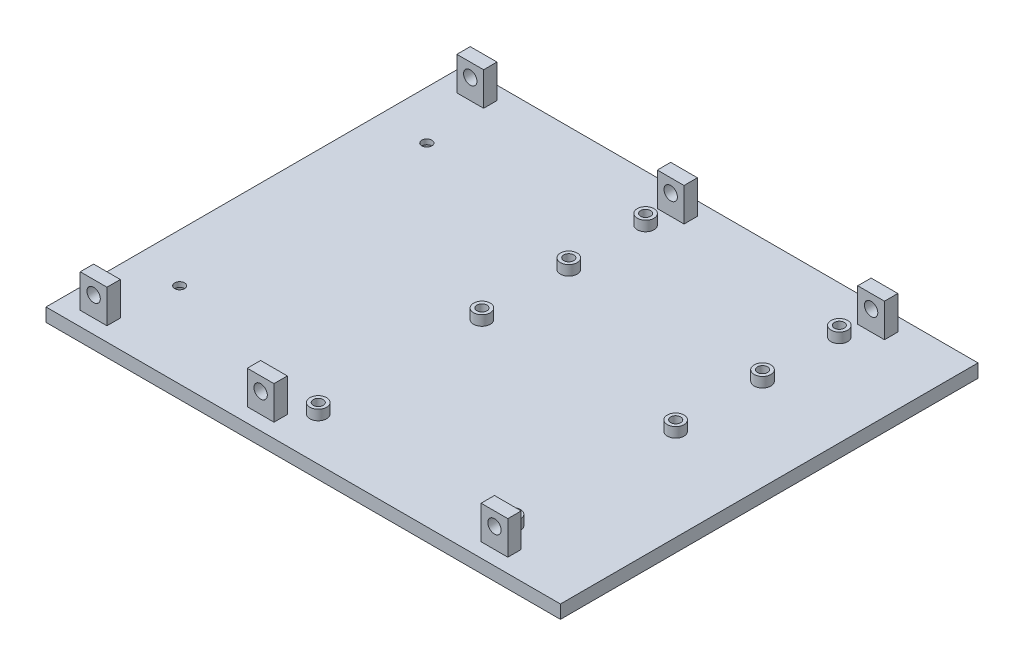
from build123d import *

# Parameters (mm, degrees)
SKETCH1_W                   = 154
SKETCH1_H                   = 125
BOSS_EXTRUDE1_DEPTH         = 4
CUT_EXTRUDE1_REACH          = 101.253
SKETCH3_R                   = 1.5
SKETCH15_R                  = 3
CUT_EXTRUDE7_DEPTH          = 2.5
CUT_EXTRUDE2_REACH          = 101.253
SKETCH4_R                   = 1.5
BOSS_EXTRUDE6_START         = 3
SKETCH17_R                  = 2.5
SKETCH17_R_2                = 1.5
BOSS_EXTRUDE6_DEPTH         = 3
LPATTERN1_COUNT             = 2
LPATTERN1_PITCH             = 58
LPATTERN2_COUNT             = 3
LPATTERN2_PITCH             = 49
LPATTERN2_COPY_1_REACH      = 101.253
LPATTERN2_COPY_1_SKETCH_R   = 1.5
LPATTERN2_COPY_2_REACH      = 101.253
LPATTERN2_COPY_2_SKETCH_R   = 1.5
LPATTERN2_START             = 3
LPATTERN2_COPY_3_SKETCH_R   = 2.5
LPATTERN2_COPY_3_SKETCH_R_2 = 1.5
LPATTERN2_COPY_3_DEPTH      = 3
LPATTERN2_COPY_4_SKETCH_R   = 2.5
LPATTERN2_COPY_4_SKETCH_R_2 = 1.5
LPATTERN2_COPY_4_DEPTH      = 3
LPATTERN3_COUNT             = 2
LPATTERN3_PITCH             = 75
LPATTERN3_COPY_1_REACH      = 101.253
LPATTERN3_COPY_1_SKETCH_R   = 1.5
LPATTERN3_START             = 3
LPATTERN3_COPY_2_SKETCH_R   = 2.5
LPATTERN3_COPY_2_SKETCH_R_2 = 1.5
LPATTERN3_COPY_2_DEPTH      = 3
SKETCH9_W                   = 8
SKETCH9_H                   = 4
BOSS_EXTRUDE4_DEPTH         = 10
CUT_EXTRUDE5_REACH          = 145.894
SKETCH10_R                  = 2
LPATTERN4_COUNT             = 2
LPATTERN4_PITCH             = 50
SKETCH12_W                  = 8
SKETCH12_H                  = 4
BOSS_EXTRUDE5_DEPTH         = 10
CUT_EXTRUDE6_REACH          = 144.588
SKETCH14_R                  = 2
LPATTERN5_COUNT             = 3
LPATTERN5_PITCH             = 60
LPATTERN6_COUNT             = 2
LPATTERN6_PITCH             = 120


with BuildPart() as part:
    # Sketch1 → Boss-Extrude1 (new body)
    with BuildSketch(Plane(origin=(0, 0, 0), x_dir=(1, 0, 0), z_dir=(0, 1, 0))):
        Rectangle(SKETCH1_W, SKETCH1_H)
    extrude(amount=BOSS_EXTRUDE1_DEPTH)

    # Sketch3 → Cut-Extrude1 (cut, up to next)
    with BuildSketch(Plane(origin=(0, 4, 0), x_dir=(1, 0, 0), z_dir=(0, 1, 0)), mode=Mode.PRIVATE) as cut_extrude1_sk1:
        with Locations(Location((-62.5, 37, 0), (0, 0, 270))):
            Circle(SKETCH3_R)
    cut_extrude1_tool1 = extrude(cut_extrude1_sk1.sketch, amount=-CUT_EXTRUDE1_REACH, mode=Mode.PRIVATE) & part.part
    cut_extrude1 = cut_extrude1_tool1.solids().sort_by_distance((-62.5, 4, -37))[0]
    add(cut_extrude1, mode=Mode.SUBTRACT)

    # Sketch15 → Cut-Extrude7 (cut)
    with BuildSketch(Plane.XZ):
        with Locations(Location((-62.5, -37, 0), (0, 0, 270))):
            Circle(SKETCH15_R)
    cut_extrude7 = extrude(amount=-CUT_EXTRUDE7_DEPTH, mode=Mode.SUBTRACT)

    # Mirror1: Cut-Extrude1, Cut-Extrude7 across plane
    add(cut_extrude1.mirror(Plane.XY), mode=Mode.SUBTRACT)
    add(cut_extrude7.mirror(Plane.XY), mode=Mode.SUBTRACT)

    # Sketch4 → Cut-Extrude2 (cut, up to next)
    with BuildSketch(Plane(origin=(0, 4, 0), x_dir=(1, 0, 0), z_dir=(0, 1, 0)), mode=Mode.PRIVATE) as cut_extrude2_sk1:
        with Locations(Location((49.5, -49.5, 0), (0, 0, 270))):
            Circle(SKETCH4_R)
    cut_extrude2_tool1 = extrude(cut_extrude2_sk1.sketch, amount=-CUT_EXTRUDE2_REACH, mode=Mode.PRIVATE) & part.part
    cut_extrude2 = cut_extrude2_tool1.solids().sort_by_distance((49.5, 4, 49.5))[0]
    add(cut_extrude2, mode=Mode.SUBTRACT)

    # Sketch17 → Boss-Extrude6 (add)
    with BuildSketch(Plane(origin=(0, 4, 0), x_dir=(1, 0, 0), z_dir=(0, 1, 0)).offset(BOSS_EXTRUDE6_START)):
        with Locations(Location((49.5, -49.5, 0), (0, 0, 90))):
            Circle(SKETCH17_R)
        with Locations(Location((49.5, -49.5, 0), (0, 0, 270))):
            Circle(SKETCH17_R_2, mode=Mode.SUBTRACT)
    boss_extrude6 = extrude(amount=-BOSS_EXTRUDE6_DEPTH)

    # LPattern1: Cut-Extrude2, Boss-Extrude6 ×2
    with Locations(*[(-i * LPATTERN1_PITCH, 0, 0) for i in range(1, LPATTERN1_COUNT)]):
        add(cut_extrude2, mode=Mode.SUBTRACT)
        add(boss_extrude6)

    # LPattern2: Cut-Extrude2, Boss-Extrude6 ×3
    with Locations(*[(0, 0, -i * LPATTERN2_PITCH) for i in range(1, LPATTERN2_COUNT)]):
        add(cut_extrude2, mode=Mode.SUBTRACT)
        add(boss_extrude6)

    # LPattern2 copy 1 sketch → LPattern2 copy 1 (cut, up to next)
    with BuildSketch(Plane(origin=(-58, 4, -49), x_dir=(1, 0, 0), z_dir=(0, 1, 0)), mode=Mode.PRIVATE) as lpattern2_copy_1_sk1:
        with Locations(Location((49.5, -49.5, 0), (0, 0, 270))):
            Circle(LPATTERN2_COPY_1_SKETCH_R)
    lpattern2_copy_1_tool1 = extrude(lpattern2_copy_1_sk1.sketch, amount=-LPATTERN2_COPY_1_REACH, mode=Mode.PRIVATE) & part.part
    add(lpattern2_copy_1_tool1.solids().sort_by_distance((-8.5, 4, 0.5))[0], mode=Mode.SUBTRACT)

    # LPattern2 copy 2 sketch → LPattern2 copy 2 (cut, up to next)
    with BuildSketch(Plane(origin=(-58, 4, -98), x_dir=(1, 0, 0), z_dir=(0, 1, 0)), mode=Mode.PRIVATE) as lpattern2_copy_2_sk1:
        with Locations(Location((49.5, -49.5, 0), (0, 0, 270))):
            Circle(LPATTERN2_COPY_2_SKETCH_R)
    lpattern2_copy_2_tool1 = extrude(lpattern2_copy_2_sk1.sketch, amount=-LPATTERN2_COPY_2_REACH, mode=Mode.PRIVATE) & part.part
    add(lpattern2_copy_2_tool1.solids().sort_by_distance((-8.5, 4, -48.5))[0], mode=Mode.SUBTRACT)

    # LPattern2 copy 3 sketch → LPattern2 copy 3 (add)
    with BuildSketch(Plane(origin=(-58, 4, -49), x_dir=(1, 0, 0), z_dir=(0, 1, 0)).offset(LPATTERN2_START)):
        with Locations(Location((49.5, -49.5, 0), (0, 0, 90))):
            Circle(LPATTERN2_COPY_3_SKETCH_R)
        with Locations(Location((49.5, -49.5, 0), (0, 0, 270))):
            Circle(LPATTERN2_COPY_3_SKETCH_R_2, mode=Mode.SUBTRACT)
    extrude(amount=-LPATTERN2_COPY_3_DEPTH)

    # LPattern2 copy 4 sketch → LPattern2 copy 4 (add)
    with BuildSketch(Plane(origin=(-58, 4, -98), x_dir=(1, 0, 0), z_dir=(0, 1, 0)).offset(LPATTERN2_START)):
        with Locations(Location((49.5, -49.5, 0), (0, 0, 90))):
            Circle(LPATTERN2_COPY_4_SKETCH_R)
        with Locations(Location((49.5, -49.5, 0), (0, 0, 270))):
            Circle(LPATTERN2_COPY_4_SKETCH_R_2, mode=Mode.SUBTRACT)
    extrude(amount=-LPATTERN2_COPY_4_DEPTH)

    # LPattern3: Cut-Extrude2, Boss-Extrude6 ×2
    with Locations(*[(0, 0, -i * LPATTERN3_PITCH) for i in range(1, LPATTERN3_COUNT)]):
        add(cut_extrude2, mode=Mode.SUBTRACT)
        add(boss_extrude6)

    # LPattern3 copy 1 sketch → LPattern3 copy 1 (cut, up to next)
    with BuildSketch(Plane(origin=(-58, 4, -75), x_dir=(1, 0, 0), z_dir=(0, 1, 0)), mode=Mode.PRIVATE) as lpattern3_copy_1_sk1:
        with Locations(Location((49.5, -49.5, 0), (0, 0, 270))):
            Circle(LPATTERN3_COPY_1_SKETCH_R)
    lpattern3_copy_1_tool1 = extrude(lpattern3_copy_1_sk1.sketch, amount=-LPATTERN3_COPY_1_REACH, mode=Mode.PRIVATE) & part.part
    add(lpattern3_copy_1_tool1.solids().sort_by_distance((-8.5, 4, -25.5))[0], mode=Mode.SUBTRACT)

    # LPattern3 copy 2 sketch → LPattern3 copy 2 (add)
    with BuildSketch(Plane(origin=(-58, 4, -75), x_dir=(1, 0, 0), z_dir=(0, 1, 0)).offset(LPATTERN3_START)):
        with Locations(Location((49.5, -49.5, 0), (0, 0, 90))):
            Circle(LPATTERN3_COPY_2_SKETCH_R)
        with Locations(Location((49.5, -49.5, 0), (0, 0, 270))):
            Circle(LPATTERN3_COPY_2_SKETCH_R_2, mode=Mode.SUBTRACT)
    extrude(amount=-LPATTERN3_COPY_2_DEPTH)

    # Sketch9 → Boss-Extrude4 (add)
    with BuildSketch(Plane(origin=(0, 4, 0), x_dir=(1, 0, 0), z_dir=(0, 1, 0))):
        with Locations((-67, -56.25)):
            Rectangle(SKETCH9_W, SKETCH9_H)
    boss_extrude4 = extrude(amount=BOSS_EXTRUDE4_DEPTH)

    # Sketch10 → Cut-Extrude5 (cut, up to next)
    with BuildSketch(Plane.XY.offset(58.25), mode=Mode.PRIVATE) as cut_extrude5_sk1:
        with Locations((-67, 10)):
            Circle(SKETCH10_R)
    cut_extrude5_tool1 = extrude(cut_extrude5_sk1.sketch, amount=-CUT_EXTRUDE5_REACH, mode=Mode.PRIVATE) & part.part
    cut_extrude5 = cut_extrude5_tool1.solids().sort_by_distance((-67, 10, 58.25))[0]
    add(cut_extrude5, mode=Mode.SUBTRACT)

    # LPattern4: Boss-Extrude4, Cut-Extrude5 ×2
    with Locations(*[(i * LPATTERN4_PITCH, 0, 0) for i in range(1, LPATTERN4_COUNT)]):
        add(boss_extrude4)
        add(cut_extrude5, mode=Mode.SUBTRACT)

    # Sketch12 → Boss-Extrude5 (add)
    with BuildSketch(Plane(origin=(-3.289149479, 4, -108.840697075), x_dir=(1, 0, 0), z_dir=(0, 1, 0))):
        with Locations((-63.710850521, -52.340697075)):
            Rectangle(SKETCH12_W, SKETCH12_H)
    boss_extrude5 = extrude(amount=BOSS_EXTRUDE5_DEPTH)

    # Sketch14 → Cut-Extrude6 (cut, up to next)
    with BuildSketch(Plane(origin=(-3.289149479, 0, -54.5), x_dir=(1, 0, 0), z_dir=(0, 0, 1)), mode=Mode.PRIVATE) as cut_extrude6_sk1:
        with Locations((-63.710850521, 10)):
            Circle(SKETCH14_R)
    cut_extrude6_tool1 = extrude(cut_extrude6_sk1.sketch, amount=-CUT_EXTRUDE6_REACH, mode=Mode.PRIVATE) & part.part
    cut_extrude6 = cut_extrude6_tool1.solids().sort_by_distance((-67, 10, -54.5))[0]
    add(cut_extrude6, mode=Mode.SUBTRACT)

    # LPattern5: Boss-Extrude5, Cut-Extrude6 ×3
    with Locations(*[(i * LPATTERN5_PITCH, 0, 0) for i in range(1, LPATTERN5_COUNT)]):
        add(boss_extrude5)
        add(cut_extrude6, mode=Mode.SUBTRACT)

    # LPattern6: Boss-Extrude4, Cut-Extrude5 ×2
    with Locations(*[(i * LPATTERN6_PITCH, 0, 0) for i in range(1, LPATTERN6_COUNT)]):
        add(boss_extrude4)
        add(cut_extrude5, mode=Mode.SUBTRACT)


solid = part.part
